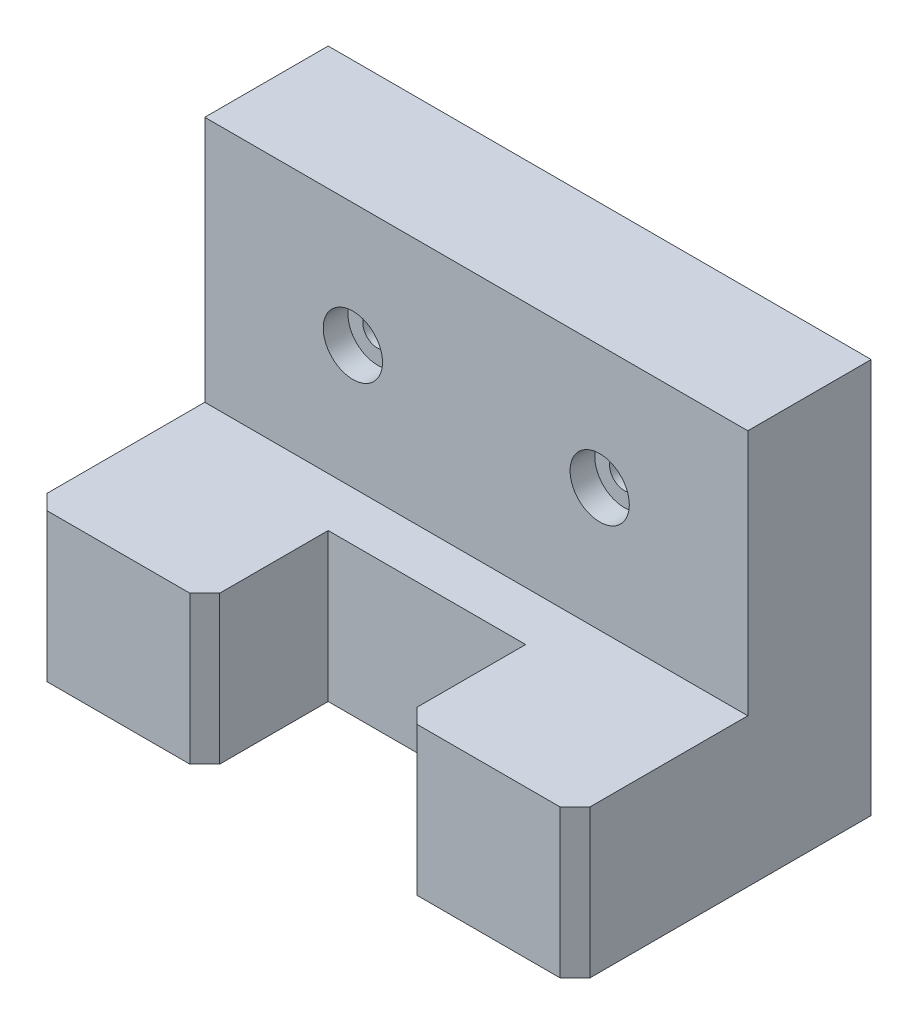
from build123d import *

# Parameters (mm, degrees)
BOSS_EXTRUDE2_DEPTH = 55
SKETCH4_W           = 40
SKETCH4_H           = 25
CUT_EXTRUDE1_DEPTH  = 83.974750358
SKETCH5_R           = 3
CUT_EXTRUDE2_DEPTH  = 104.198837203
SKETCH6_R           = 6
CUT_EXTRUDE3_DEPTH  = 5
CHAMFER1_SIZE       = 3


with BuildPart() as part:
    # Sketch3 → Boss-Extrude2 (new, symmetric)
    with BuildSketch(Plane(origin=(0, 0, 0), x_dir=(0, 0, -1), z_dir=(1, 0, 0))):
        Polygon((-23.124409198, 0), (36.875590802, 0), (36.875590802, 80), (11.875590802, 80), (11.875590802, 30), (-23.124409198, 30), align=None)
    extrude(amount=BOSS_EXTRUDE2_DEPTH, both=True)

    # Sketch4 → Cut-Extrude1 (cut, through all)
    with BuildSketch(Plane(origin=(0, 30, 0), x_dir=(1, 0, 0), z_dir=(0, 1, 0))):
        with Locations((0, -10.624409198)):
            Rectangle(SKETCH4_W, SKETCH4_H)
    extrude(amount=-CUT_EXTRUDE1_DEPTH, mode=Mode.SUBTRACT)

    # Sketch5 → Cut-Extrude2 (cut, through all)
    with BuildSketch(Plane.XY.offset(-11.875590802)):
        with Locations((-25, 55)):
            Circle(SKETCH5_R)
        with Locations((25, 55)):
            Circle(SKETCH5_R)
    extrude(amount=-CUT_EXTRUDE2_DEPTH, mode=Mode.SUBTRACT)

    # Sketch6 → Cut-Extrude3 (cut)
    with BuildSketch(Plane.XY.offset(-11.875590802)):
        with Locations((-25, 55)):
            Circle(SKETCH6_R)
        with Locations((25, 55)):
            Circle(SKETCH6_R)
    extrude(amount=-CUT_EXTRUDE3_DEPTH, mode=Mode.SUBTRACT)

    # Chamfer1
    chamfer1_edges = [part.edges().sort_by_distance(p)[0] for p in [
        (-20, 15, 23.124409198),
        (20, 15, 23.124409198),
        (55, 15, 23.124409198),
        (-55, 15, 23.124409198),
    ]]
    chamfer(chamfer1_edges, length=CHAMFER1_SIZE)


solid = part.part
